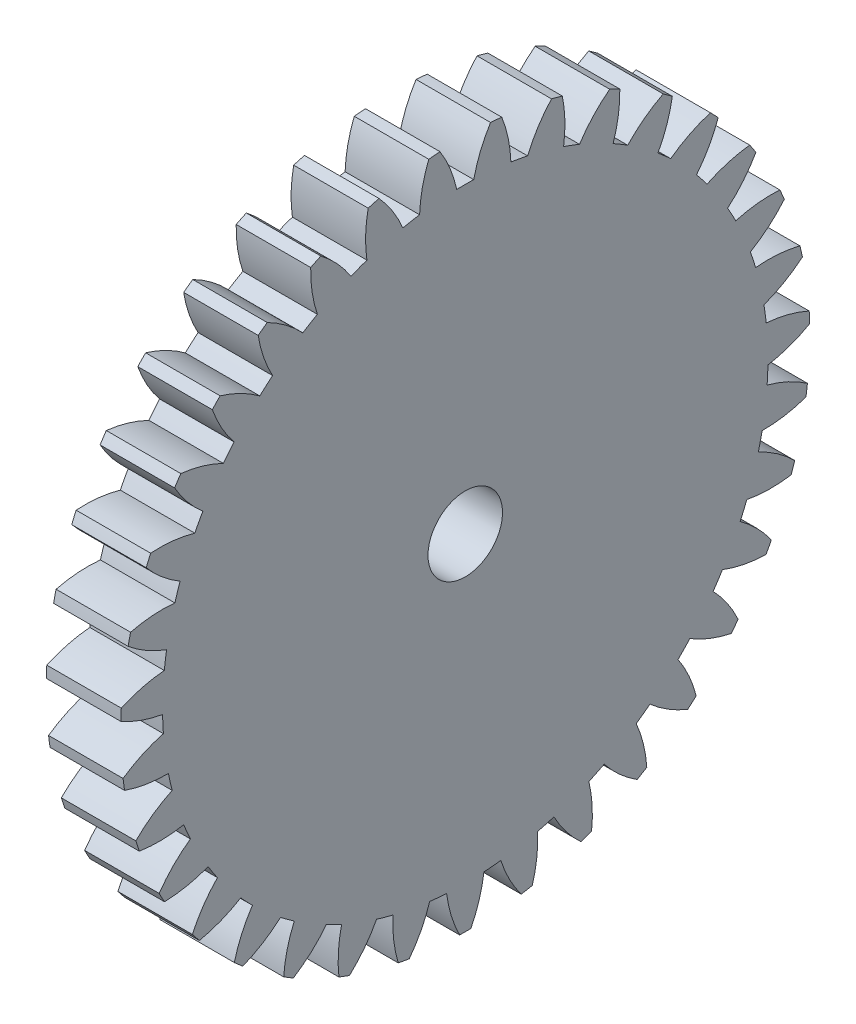
from build123d import *

# Parameters (mm, degrees)
BASPROSKE_W     = 4
BASPROSKE_H     = 18.5
TOOTHCUT_DEPTH  = 27.466960536
TEETHCUTS_COUNT = 35
TEETHCUTS_ANGLE = 349.714285714
BORSKE_R        = 2
BORE_DEPTH      = 50.0000508


with BuildPart() as part:
    # BasProSke → Base-Revolve (revolve)
    with BuildSketch(Plane(origin=(0, 0, 0), x_dir=(1, 0, 0), z_dir=(0, 1, 0)), mode=Mode.PRIVATE) as base_revolve_sk:
        with Locations((2, 9.25)):
            Rectangle(BASPROSKE_W, BASPROSKE_H)
    revolve(base_revolve_sk.sketch.rotate(Axis((-10, 0, 0), (1, 0, 0)), 180), axis=Axis((-10, 0, 0), (1, 0, 0)))

    # TooCutSke → ToothCut (cut, through all)
    with BuildSketch(Plane(origin=(0, 0, 0), x_dir=(0, 0, -1), z_dir=(1, 0, 0))):
        with BuildLine():
            ThreePointArc((0.456361119, 16.242590173), (0, 16.249), (-0.456361119, 16.242590173))
            ThreePointArc((-0.456361119, 16.242590173), (-0.817781123, 17.39831105), (-1.372969849, 18.474452602))
            ThreePointArc((-1.372969849, 18.474452602), (0, 18.5254), (1.372969849, 18.474452602))
            ThreePointArc((1.372969849, 18.474452602), (0.817781123, 17.39831105), (0.456361119, 16.242590173))
        make_face()
    toothcut = extrude(amount=TOOTHCUT_DEPTH, mode=Mode.SUBTRACT)

    # TeethCuts: ToothCut ×35 about axis
    teethcuts_axis = Axis((-10, 0, 0), (1, 0, 0))
    for i in range(1, TEETHCUTS_COUNT):
        add(toothcut.rotate(teethcuts_axis, i * TEETHCUTS_ANGLE / (TEETHCUTS_COUNT - 1)), mode=Mode.SUBTRACT)

    # BorSke → Bore (cut, symmetric)
    with BuildSketch(Plane(origin=(0, 0, 0), x_dir=(0, 0, -1), z_dir=(1, 0, 0))):
        with Locations(Location((0, 0, 0), (0, 0, 180))):
            Circle(BORSKE_R)
    extrude(amount=BORE_DEPTH, both=True, mode=Mode.SUBTRACT)


solid = part.part
